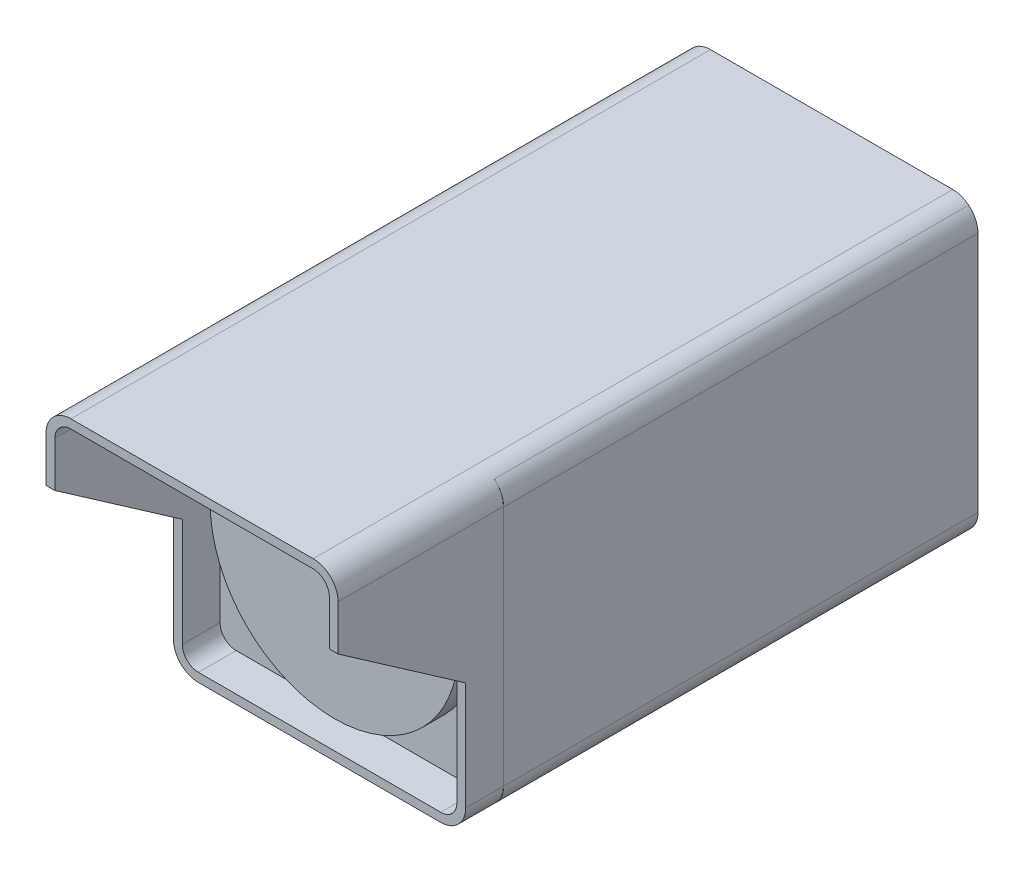
from build123d import *

# Parameters (mm, degrees)
BOSS_EXTRUDE1_DEPTH = 7698
BOSS_EXTRUDE2_DEPTH = 5709
CUT_EXTRUDE1_DEPTH  = 5709
SKETCH5_R           = 688.921896872
SKETCH5_R_2         = 500
BOSS_EXTRUDE3_DEPTH = 102
SKETCH7_R           = 1495.868851997
BOSS_EXTRUDE4_DEPTH = 275


with BuildPart() as part:
    # Sketch2 → Boss-Extrude1 (new body)
    with BuildSketch(Plane.XY):
        with BuildLine():
            Line((1458.220709409, -1758.220709409), (-1458.220709409, -1758.220709409))
            ThreePointArc((-1458.220709409, -1758.220709409), (-1670.352743765, -1670.352743765), (-1758.220709409, -1458.220709409))
            Line((-1758.220709409, -1458.220709409), (-1758.220709409, 1458.220709409))
            ThreePointArc((-1758.220709409, 1458.220709409), (-1670.352743765, 1670.352743765), (-1458.220709409, 1758.220709409))
            Line((-1458.220709409, 1758.220709409), (1458.220709409, 1758.220709409))
            ThreePointArc((1458.220709409, 1758.220709409), (1670.352743765, 1670.352743765), (1758.220709409, 1458.220709409))
            Line((1758.220709409, 1458.220709409), (1758.220709409, -1458.220709409))
            ThreePointArc((1758.220709409, -1458.220709409), (1670.352743765, -1670.352743765), (1458.220709409, -1758.220709409))
        make_face()
        with BuildLine():
            Line((1458.220709409, 1652.220709409), (-1458.220709409, 1652.220709409))
            ThreePointArc((-1458.220709409, 1652.220709409), (-1595.399424959, 1595.399424959), (-1652.220709409, 1458.220709409))
            Line((-1652.220709409, 1458.220709409), (-1652.220709409, -1458.220709409))
            ThreePointArc((-1652.220709409, -1458.220709409), (-1595.399424959, -1595.399424959), (-1458.220709409, -1652.220709409))
            Line((-1458.220709409, -1652.220709409), (1458.220709409, -1652.220709409))
            ThreePointArc((1458.220709409, -1652.220709409), (1595.399424959, -1595.399424959), (1652.220709409, -1458.220709409))
            Line((1652.220709409, -1458.220709409), (1652.220709409, 1458.220709409))
            ThreePointArc((1652.220709409, 1458.220709409), (1595.399424959, 1595.399424959), (1458.220709409, 1652.220709409))
        make_face(mode=Mode.SUBTRACT)
    extrude(amount=BOSS_EXTRUDE1_DEPTH)

    # Sketch3 → Boss-Extrude2 (add)
    with BuildSketch(Plane(origin=(0, 0, 0), x_dir=(-1, 0, 0), z_dir=(0, 0, -1))):
        with BuildLine():
            Line((1462.266623483, -1754.947873154), (-1462.266623483, -1754.947873154))
            ThreePointArc((-1462.266623483, -1754.947873154), (-1674.398657839, -1667.07990751), (-1762.266623483, -1454.947873154))
            Line((-1762.266623483, -1454.947873154), (-1762.266623483, 1454.947873154))
            ThreePointArc((-1762.266623483, 1454.947873154), (-1674.398657839, 1667.07990751), (-1462.266623483, 1754.947873154))
            Line((-1462.266623483, 1754.947873154), (1462.266623483, 1754.947873154))
            ThreePointArc((1462.266623483, 1754.947873154), (1674.398657839, 1667.07990751), (1762.266623483, 1454.947873154))
            Line((1762.266623483, 1454.947873154), (1762.266623483, -1454.947873154))
            ThreePointArc((1762.266623483, -1454.947873154), (1674.398657839, -1667.07990751), (1462.266623483, -1754.947873154))
        make_face()
    extrude(amount=-BOSS_EXTRUDE2_DEPTH)

    # Sketch4 → Cut-Extrude1 (cut)
    with BuildSketch(Plane(origin=(1758.220709409, 0, 0), x_dir=(0, 0, -1), z_dir=(1, 0, 0))):
        Polygon((-7698, 914.449134534), (-7698, -1758.220709409), (-6163.089789465, -1758.220709409), (-6163.089789465, -153.979819584), align=None)
    extrude(amount=-CUT_EXTRUDE1_DEPTH, mode=Mode.SUBTRACT)

    # Sketch5 → Boss-Extrude3 (add)
    with BuildSketch(Plane.XZ.offset(1758.220709409)):
        with Locations((0, 1152.401140837)):
            Circle(SKETCH5_R)
        with Locations((0, 1152.401140837)):
            Circle(SKETCH5_R_2, mode=Mode.SUBTRACT)
    extrude(amount=BOSS_EXTRUDE3_DEPTH)

    # Sketch7 → Boss-Extrude4 (add)
    with BuildSketch(Plane.XY.offset(5709)):
        Circle(SKETCH7_R)
    extrude(amount=BOSS_EXTRUDE4_DEPTH)


solid = part.part
